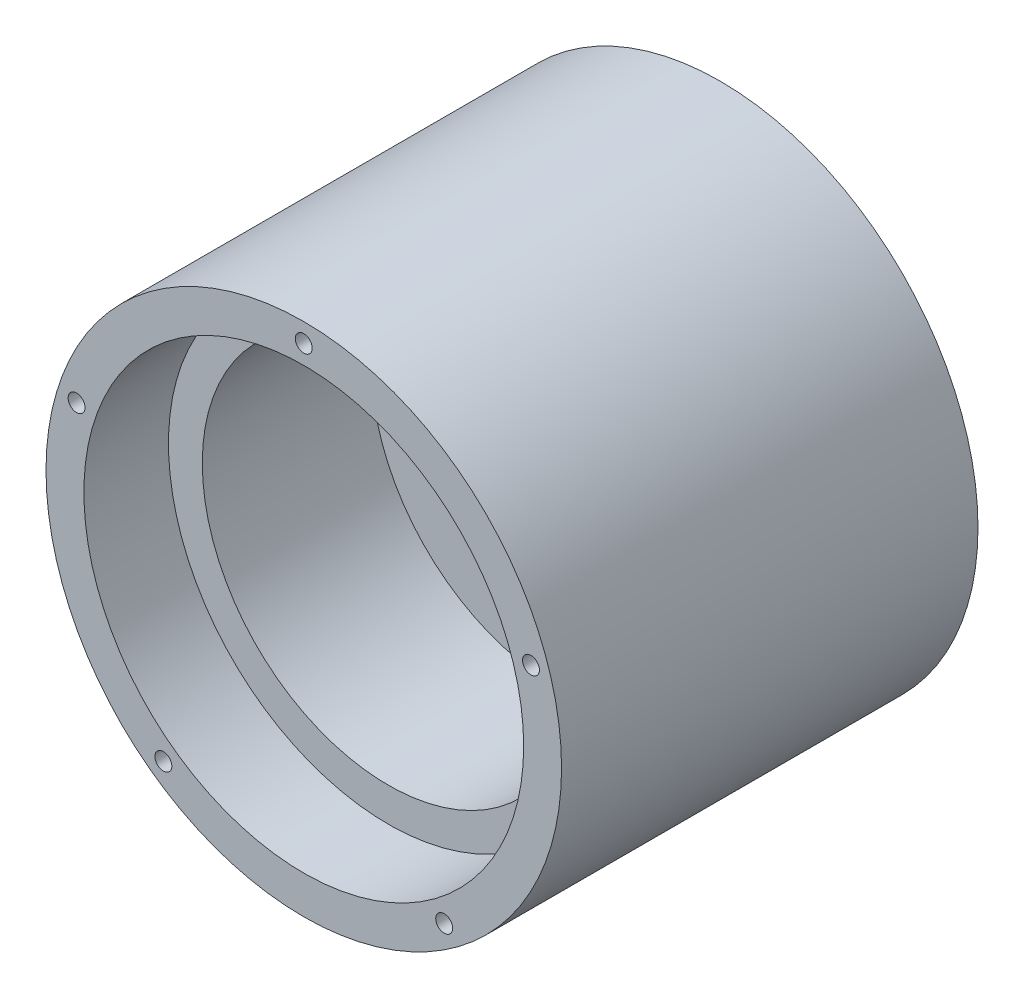
from build123d import *

# Parameters (mm, degrees)
SKETCH2_R           = 76.2
BOSS_EXTRUDE1_DEPTH = 85
SKETCH4_R           = 65
CUT_EXTRUDE2_DEPTH  = 25
SKETCH5_R           = 55
CUT_EXTRUDE3_DEPTH  = 50
SKETCH7_R           = 2.5
CUT_EXTRUDE4_DEPTH  = 20
CIRPATTERN1_COUNT   = 5
BOSS_EXTRUDE2_START = 38.1
SKETCH8_R           = 76.2
SKETCH8_R_2         = 50.8
BOSS_EXTRUDE2_DEPTH = 38.1
CUT_EXTRUDE5_DEPTH  = 66.04
CIRPATTERN2_COUNT   = 4
SKETCH12_R          = 69.85
CUT_EXTRUDE6_DEPTH  = 25.4


with BuildPart() as part:
    # Sketch2 → Boss-Extrude1 (new body)
    with BuildSketch(Plane(origin=(0, 0, 0), x_dir=(0, 1, 0), z_dir=(0, 0, 1))):
        with Locations(Location((0, 0, 0), (0, 0, 270))):
            Circle(SKETCH2_R)
    extrude(amount=BOSS_EXTRUDE1_DEPTH)

    # Sketch4 → Cut-Extrude2 (cut)
    with BuildSketch(Plane.XY.offset(85)):
        Circle(SKETCH4_R)
    extrude(amount=-CUT_EXTRUDE2_DEPTH, mode=Mode.SUBTRACT)

    # Sketch5 → Cut-Extrude3 (cut)
    with BuildSketch(Plane.XY.offset(60)):
        Circle(SKETCH5_R)
    extrude(amount=-CUT_EXTRUDE3_DEPTH, mode=Mode.SUBTRACT)

    # Sketch7 → Cut-Extrude4 (cut)
    with BuildSketch(Plane.XY.offset(85)):
        with Locations((0, 70.612)):
            Circle(SKETCH7_R)
    cut_extrude4 = extrude(amount=-CUT_EXTRUDE4_DEPTH, mode=Mode.SUBTRACT)

    # CirPattern1: Cut-Extrude4 ×5 about axis
    cirpattern1_axis = Axis((0, 0, 0), (0, 0, 1))
    for i in range(1, CIRPATTERN1_COUNT):
        add(cut_extrude4.rotate(cirpattern1_axis, i * 360 / CIRPATTERN1_COUNT), mode=Mode.SUBTRACT)

    # Sketch8 → Boss-Extrude2 (add)
    with BuildSketch(Plane(origin=(0, 0, 0), x_dir=(1, 0, 0), z_dir=(0, 0, -1)).offset(BOSS_EXTRUDE2_START)):
        with Locations(Location((0, 0, 0), (0, 0, 180))):
            Circle(SKETCH8_R)
        Circle(SKETCH8_R_2, mode=Mode.SUBTRACT)
    extrude(amount=-BOSS_EXTRUDE2_DEPTH)

    # Sketch10 → Cut-Extrude5 (cut)
    with BuildSketch(Plane(origin=(0, 0, 0), x_dir=(-1, 0, 0), z_dir=(0, 1, 0))):
        Polygon((-6.35, 0), (-6.35, -38.1), (6.35, -38.1), (6.35, -6.35), (26.709025115, -6.35), (26.709025115, 0), align=None)
    cut_extrude5 = extrude(amount=-CUT_EXTRUDE5_DEPTH, mode=Mode.SUBTRACT)

    # CirPattern2: Cut-Extrude5 ×4 about axis
    cirpattern2_axis = Axis((0, 0, 0), (0, 0, 1))
    for i in range(1, CIRPATTERN2_COUNT):
        add(cut_extrude5.rotate(cirpattern2_axis, i * 360 / CIRPATTERN2_COUNT), mode=Mode.SUBTRACT)

    # Sketch12 → Cut-Extrude6 (cut)
    with BuildSketch(Plane(origin=(0, 0, -38.1), x_dir=(1, 0, 0), z_dir=(0, 0, -1))):
        with Locations(Location((0, 0, 0), (0, 0, 180))):
            Circle(SKETCH12_R)
    extrude(amount=-CUT_EXTRUDE6_DEPTH, mode=Mode.SUBTRACT)


solid = part.part
